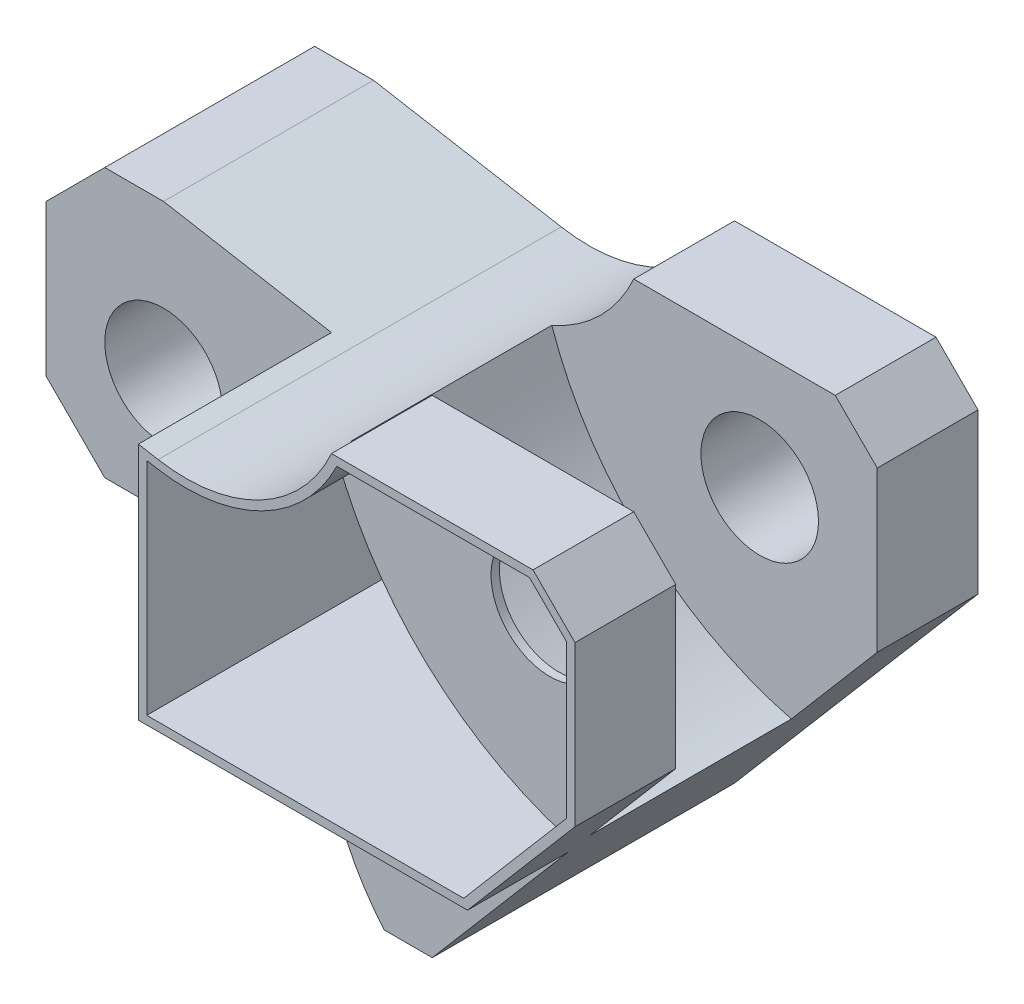
from build123d import *

# Parameters (mm, degrees)
SKETCH1_R           = 7
BOSS_EXTRUDE1_DEPTH = 25
BOSS_EXTRUDE2_START = 12
BOSS_EXTRUDE2_DEPTH = 24
SKETCH1_4_R         = 7.000000000000007
BOSS_EXTRUDE3_DEPTH = 12
BOSS_EXTRUDE6_START = 36
SKETCH1_7_R         = 7.000000000000007
BOSS_EXTRUDE6_DEPTH = 12
SHELL7_T            = -1
BOSS_EXTRUDE7_DEPTH = 36
SKETCH2_R           = 9.695738558294309
CUT_EXTRUDE2_DEPTH  = 93.13576938409969


with BuildPart() as part:
    # Sketch1 → Boss-Extrude1 (new body)
    with BuildSketch(Plane.XY):
        Polygon((-72, -1.421e-14), (-72, -18.000000000000014), (-64.99999999999997, -25.000000000000014), (-38, -25.000000000000007), (-38.00000000000001, 3.4734603858306787), (-57.99999999999999, 6.999999999999986), (-65.00000000000001, 6.999999999999986), align=None)
        with Locations((-57.99999999999999, -11.000000000000014)):
            Circle(SKETCH1_R, mode=Mode.SUBTRACT)
    extrude(amount=BOSS_EXTRUDE1_DEPTH)

    # Sketch1<4> → Boss-Extrude3 (add)
    with BuildSketch(Plane.XY):
        with BuildLine():
            Line((-38.00000000000001, 3.4734603858306787), (-38, -25.000000000000014))
            Line((-38, -25.00000000000001), (1.2058823529411669, -25.00000000000001))
            Line((1.2058823529411677, -25.00000000000001), (14.000000000000004, -10))
            Line((14, -9.999999999999998), (13.999999999999998, 9.000000000000002))
            Line((13.999999999999998, 9.000000000000002), (8.999999999999979, 14))
            Line((8.999999999999979, 14), (-15.000000000000004, 14))
            ThreePointArc((-15.000000000000004, 14), (-23.43890129432416, 4.98204414221815), (-35.63861916422293, 3.057085232755277))
            Line((-35.63861916422293, 3.057085232755278), (-38.00000000000001, 3.4734603858306823))
        make_face()
        Circle(SKETCH1_4_R, mode=Mode.SUBTRACT)
    extrude(amount=BOSS_EXTRUDE3_DEPTH)

    # Sketch1<8> → Boss-Extrude7 (add)
    with BuildSketch(Plane.XY):
        with BuildLine():
            Line((1.2058823529411669, -25.00000000000001), (-32.424461088659314, -25.00000000000001))
            ThreePointArc((-32.424461088659314, -25.000000000000007), (-29.159225307604235, -26.213413767769495), (-27.478822347247476, -29.26470588235295))
            ThreePointArc((-27.47882234724748, -29.264705882352946), (-25.141992144084263, -37.11567206097118), (-20.70301994726548, -44.000000000000014))
            Line((-20.70301994726548, -44.000000000000014), (-14.999999999999996, -44.00000000000001))
            Line((-14.999999999999996, -44.00000000000001), (1.2058823529411704, -25.00000000000001))
        make_face()
    extrude(amount=BOSS_EXTRUDE7_DEPTH)


with BuildPart() as body_2:
    # Sketch1<3> → Boss-Extrude2 (new body)
    with BuildSketch(Plane.XY.offset(BOSS_EXTRUDE2_START)):
        with BuildLine():
            Line((-38.00000000000001, 3.4734603858306787), (-38, -25.000000000000014))
            Line((-38, -25.000000000000007), (-32.424461088659314, -25.000000000000007))
            Line((-32.424461088659314, -25.00000000000001), (1.2058823529411669, -25.00000000000001))
            Line((1.2058823529411704, -25.00000000000001), (3.764705882352942, -22))
            ThreePointArc((3.764705882352942, -22.000000000000004), (-13.815737017505185, -12.419294771345367), (-24.763063450975714, 4.344294617344023))
            ThreePointArc((-24.76306345097571, 4.344294617344016), (-30.106088890163186, 2.9001323723087005), (-35.63861916422293, 3.0570852327552736))
            Line((-35.63861916422293, 3.057085232755278), (-38.00000000000001, 3.4734603858306823))
        make_face()
    extrude(amount=BOSS_EXTRUDE2_DEPTH)

    # Sketch1<7> → Boss-Extrude6 (add)
    with BuildSketch(Plane.XY.offset(BOSS_EXTRUDE6_START)):
        with BuildLine():
            Line((-38.00000000000001, 3.4734603858306787), (-38, -25.000000000000014))
            Line((-38, -25.00000000000001), (1.2058823529411669, -25.00000000000001))
            Line((1.2058823529411677, -25.00000000000001), (14.000000000000004, -10))
            Line((14, -9.999999999999998), (13.999999999999998, 9.000000000000002))
            Line((13.999999999999998, 9.000000000000002), (8.999999999999979, 14))
            Line((8.999999999999979, 14), (-15.000000000000004, 14))
            ThreePointArc((-15.000000000000004, 14), (-23.43890129432416, 4.98204414221815), (-35.63861916422293, 3.057085232755277))
            Line((-35.63861916422293, 3.057085232755278), (-38.00000000000001, 3.4734603858306823))
        make_face()
        Circle(SKETCH1_7_R, mode=Mode.SUBTRACT)
    extrude(amount=BOSS_EXTRUDE6_DEPTH)

    # Shell7
    shell7_openings = [body_2.faces().sort_by_distance(p)[0] for p in [
        (-12.583479215, -7.183735209, 48),
    ]]
    offset(amount=SHELL7_T, openings=shell7_openings, kind=Kind.INTERSECTION)


with BuildPart() as part_1:
    add(part.part)

    # Combine1: union body 2
    add(body_2.part)

    # Sketch2 → Cut-Extrude2 (cut, through all)
    with BuildSketch(Plane.XY.offset(37)):
        Circle(SKETCH2_R)
    extrude(amount=CUT_EXTRUDE2_DEPTH, mode=Mode.SUBTRACT)


solid = part_1.part
